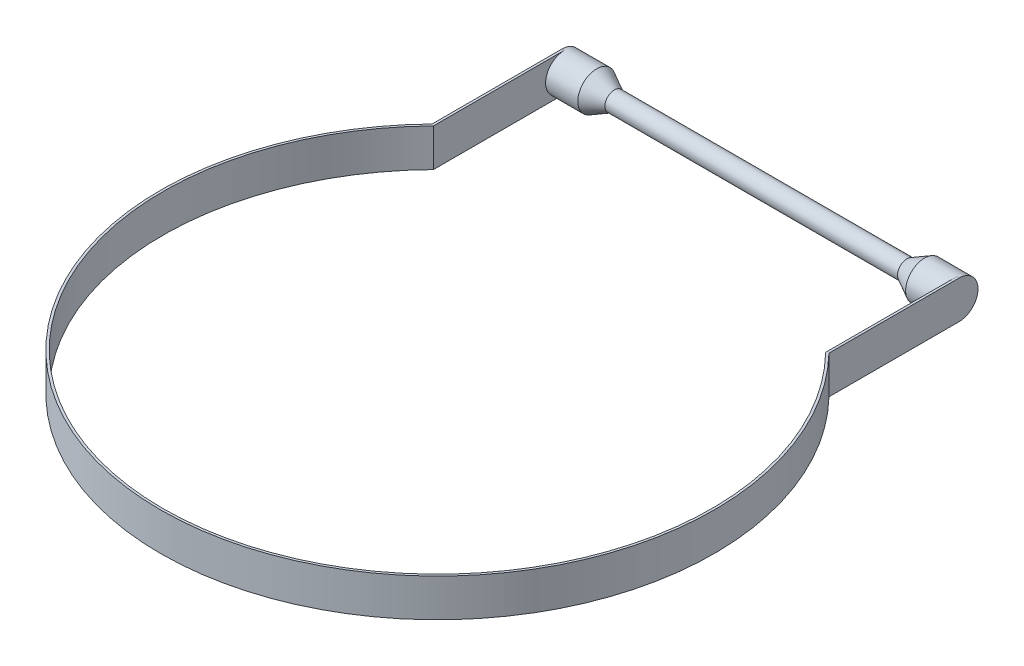
from build123d import *

# Parameters (mm, degrees)
BOSS_EXTRUDE1_DEPTH = 24.125
CUT_EXTRUDE1_DEPTH  = 977.298322892


with BuildPart() as part:
    # Sketch1 → Revolve1 (revolve)
    with BuildSketch(Plane(origin=(0, 0, 0), x_dir=(1, 0, 0), z_dir=(0, 1, 0)), mode=Mode.PRIVATE) as revolve1_sk:
        Polygon((-250, 0), (250, 0), (250, 24.125), (209, 24.125), (186.495513174, 12.0625), (0, 12.0625), (-186.495513174, 12.0625), (-209, 24.125), (-250, 24.125), align=None)
    revolve(revolve1_sk.sketch.rotate(Axis((-250, 0, 0), (1, 0, 0)), 180), axis=Axis((-250, 0, 0), (1, 0, 0)))

    # Sketch3 → Boss-Extrude1 (add, symmetric)
    with BuildSketch(Plane(origin=(0, 0, 0), x_dir=(1, 0, 0), z_dir=(0, 1, 0))):
        with BuildLine():
            Line((-253.005, 0), (-253.005, -165.889796395))
            ThreePointArc((-253.005, -165.889796395), (0, -765.0675), (253.005, -165.889796395))
            Line((253.005, -165.889796395), (253.005, 0))
            Line((253.005, 0), (253.005, 24.125))
            Line((253.005, 24.125), (250, 24.125))
            Line((250, 24.125), (250, 0))
            Line((250, 0), (250, -167.113525722))
            ThreePointArc((250, -167.113525722), (0, -762.0625), (-250, -167.113525722))
            Line((-250, -167.113525722), (-250, 0))
            Line((-250, 0), (-250, 24.125))
            Line((-250, 24.125), (-253.005, 24.125))
            Line((-253.005, 24.125), (-253.005, 0))
        make_face()
    extrude(amount=BOSS_EXTRUDE1_DEPTH, both=True)

    # Sketch4 → Cut-Extrude1 (cut, through all)
    with BuildSketch(Plane.ZY.offset(253.005)):
        with BuildLine():
            ThreePointArc((-24.125, -2.4e-08), (-17.058951105, 17.058951087), (0, 24.125))
            Line((0, 24.125), (-24.125, 24.125))
            Line((-24.125, 24.125), (-24.125, -2.4e-08))
        make_face()
        with BuildLine():
            ThreePointArc((0, -24.125), (-17.058951087, -17.058951105), (-24.125, -2.4e-08))
            Line((-24.125, -2.4e-08), (-24.125, -24.125))
            Line((-24.125, -24.125), (0, -24.125))
        make_face()
    extrude(amount=-CUT_EXTRUDE1_DEPTH, mode=Mode.SUBTRACT)


solid = part.part
